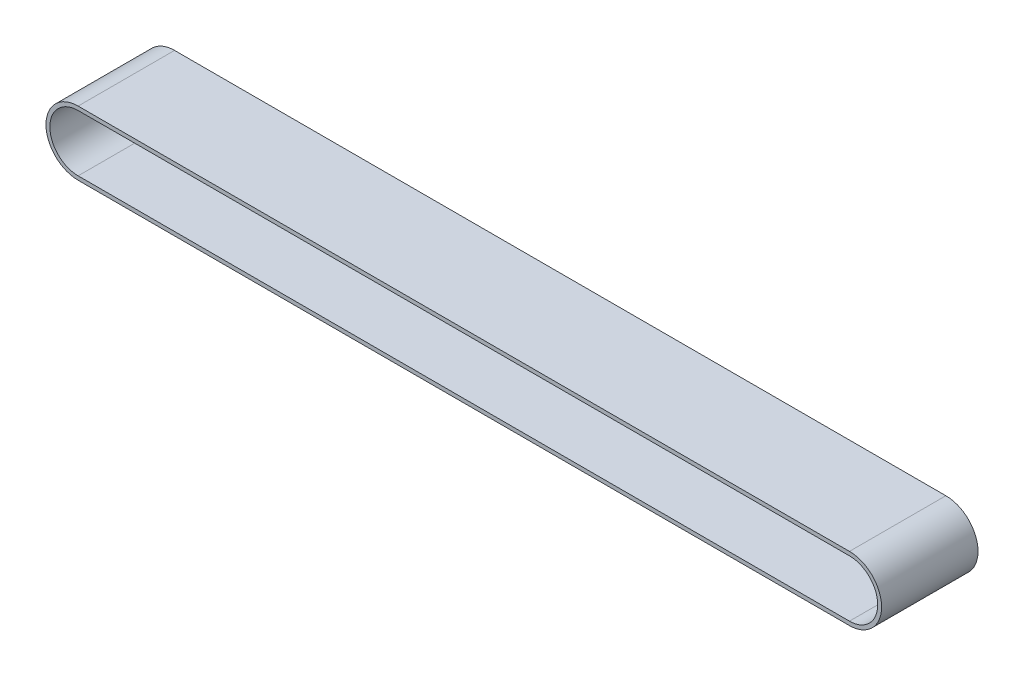
from build123d import *

# Parameters (mm, degrees)
BOSS_EXTRUDE1_DEPTH = 75


with BuildPart() as part:
    # Sketch1 → Boss-Extrude1 (new, symmetric)
    with BuildSketch(Plane.XY):
        with BuildLine():
            Line((0, -50), (1200, -50))
            ThreePointArc((1200, -50), (1250, 0), (1200, 50))
            Line((1200, 50), (0, 50))
            ThreePointArc((0, 50), (-50, 0), (0, -50))
        make_face()
        with BuildLine():
            ThreePointArc((0, 44), (-44, 0), (0, -44))
            Line((0, -44), (1200, -44))
            ThreePointArc((1200, -44), (1244, 0), (1200, 44))
            Line((1200, 44), (0, 44))
        make_face(mode=Mode.SUBTRACT)
    extrude(amount=BOSS_EXTRUDE1_DEPTH, both=True)


solid = part.part
